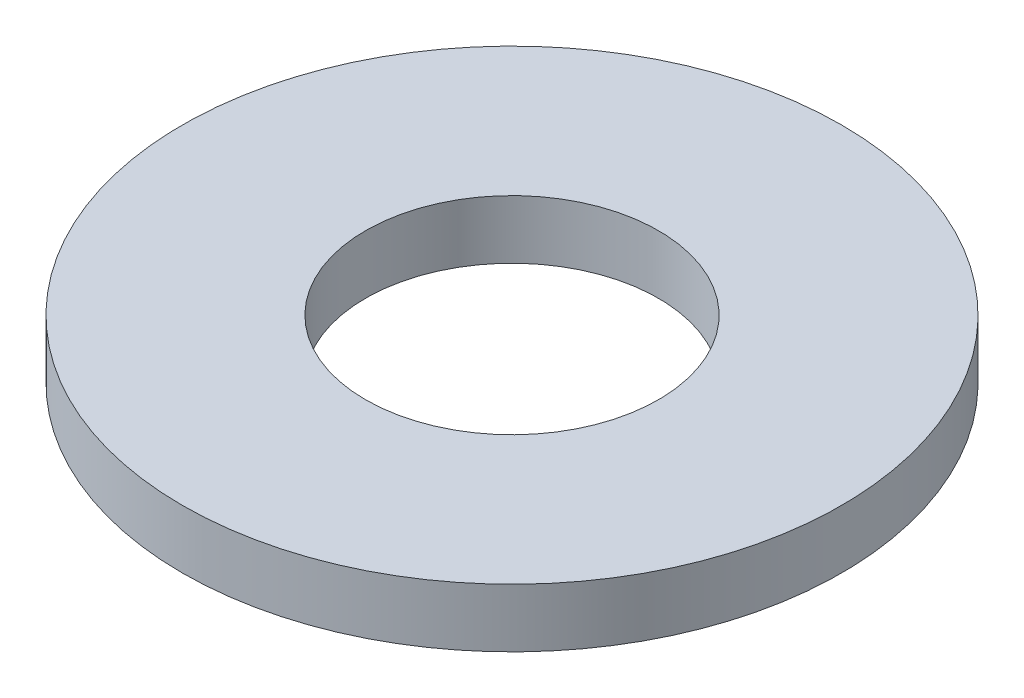
from build123d import *

# Parameters (mm, degrees)
SKETCH_1_R      = 9
SKETCH_1_R_2    = 4
EXTRUDE_1_DEPTH = 1.6


with BuildPart() as part:
    # ｽｹｯﾁ1 → ﾎﾞｽ - 押し出し1 (new body)
    with BuildSketch(Plane(origin=(0, 0, 0), x_dir=(1, 0, 0), z_dir=(0, 1, 0))):
        with Locations(Location((0, 0, 0), (0, 0, 270))):
            Circle(SKETCH_1_R)
        with Locations(Location((0, 0, 0), (0, 0, 270))):
            Circle(SKETCH_1_R_2, mode=Mode.SUBTRACT)
    extrude(amount=EXTRUDE_1_DEPTH)


solid = part.part
